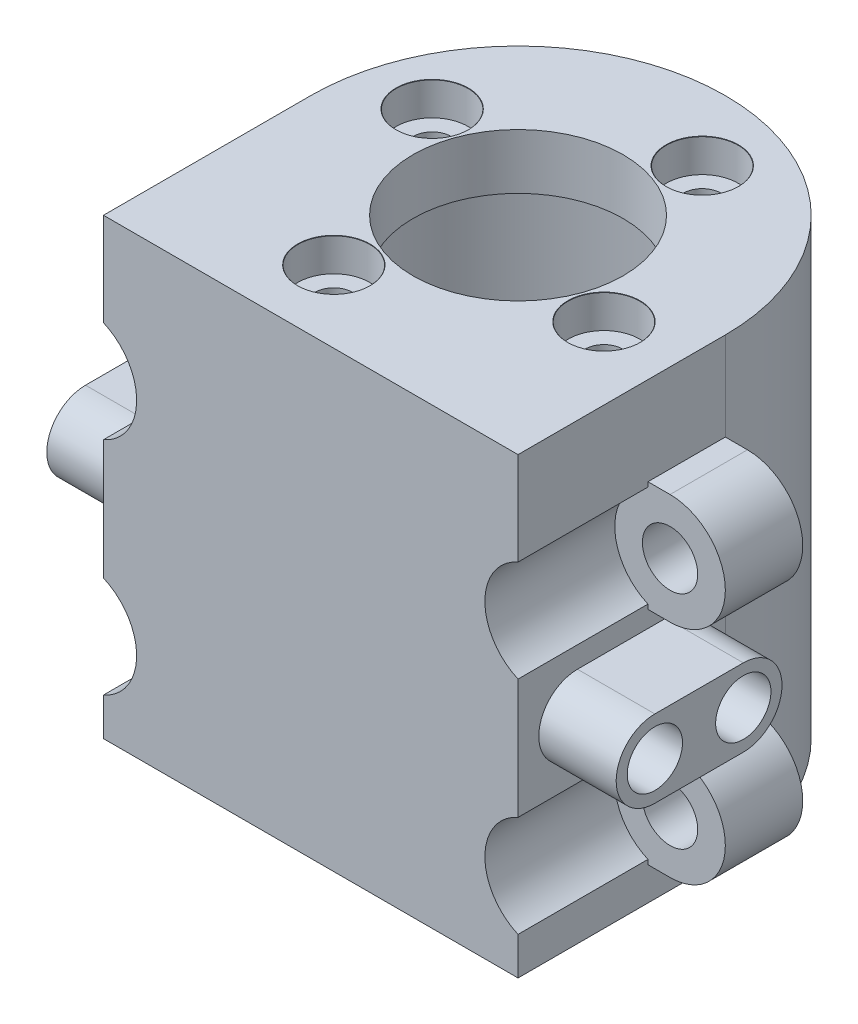
from build123d import *

# Parameters (mm, degrees)
SKETCH1_R                     = 18.75
SKETCH1_R_2                   = 16.2
BOSS_EXTRUDE1_DEPTH           = 36
BOSS_EXTRUDE2_DEPTH           = 7
CUT_EXTRUDE2_START            = 7
CUT_EXTRUDE2_DEPTH            = 11.75
CUT_EXTRUDE5_START            = 7
CUT_EXTRUDE5_DEPTH            = 5
SKETCH8_R                     = 2.5
BOSS_EXTRUDE5_DEPTH           = 7
BOSS_EXTRUDE4_DEPTH           = 5
CUT_EXTRUDE3_REACH            = 53.919
SKETCH4_R                     = 9.5
CBORE_FOR_M3_SHCS1_AT_2_COUNT = 2
CBORE_FOR_M3_SHCS1_AT_2_PITCH = 18.384776311
CBORE_FOR_M3_SHCS1_AT_3_COUNT = 2
CBORE_FOR_M3_SHCS1_AT_3_PITCH = 26
CBORE_FOR_M3_SHCS1_AT_4_COUNT = 2
CBORE_FOR_M3_SHCS1_AT_4_PITCH = 18.384776311


with BuildPart() as part:
    # Sketch1 → Boss-Extrude1 (new body)
    # profile 1 of 3: a face of its own
    with BuildSketch(Plane(origin=(0, 0, 0), x_dir=(1, 0, 0), z_dir=(0, 1, 0))):
        with BuildLine():
            ThreePointArc((0, -18.75), (-13.258252147, -13.258252147), (-18.75, 0))
            Line((-18.75, 0), (-18.75, -18.75))
            Line((-18.75, -18.75), (0, -18.75))
        make_face()
    # profile 2 of 3: a face of its own
    with BuildSketch(Plane(origin=(0, 0, 0), x_dir=(1, 0, 0), z_dir=(0, 1, 0))):
        Circle(SKETCH1_R)
        with Locations(Location((0, 0, 0), (0, 0, 270))):
            Circle(SKETCH1_R_2, mode=Mode.SUBTRACT)
    # profile 3 of 3: a face of its own
    with BuildSketch(Plane(origin=(0, 0, 0), x_dir=(1, 0, 0), z_dir=(0, 1, 0))):
        with BuildLine():
            Line((18.75, -18.75), (18.75, 0))
            ThreePointArc((18.75, 0), (13.258252147, -13.258252147), (0, -18.75))
            Line((0, -18.75), (18.75, -18.75))
        make_face()
    extrude(amount=BOSS_EXTRUDE1_DEPTH)

    # Sketch2 → Boss-Extrude2 (add)
    with BuildSketch(Plane.XY):
        with BuildLine():
            Line((18.75, 33), (18.75, 23))
            Line((18.75, 23), (20.75, 23))
            ThreePointArc((20.75, 23), (25.75, 28), (20.75, 33))
            Line((20.75, 33), (18.75, 33))
        make_face()
        with BuildLine():
            Line((20.75, 13), (18.75, 13))
            Line((18.75, 13), (18.75, 3))
            Line((18.75, 3), (20.75, 3))
            ThreePointArc((20.75, 3), (25.75, 8), (20.75, 13))
        make_face()
    boss_extrude2 = extrude(amount=BOSS_EXTRUDE2_DEPTH)

    # Sketch2<5> → Cut-Extrude2 (cut)
    with BuildSketch(Plane.XY.offset(CUT_EXTRUDE2_START)):
        with BuildLine():
            ThreePointArc((18.75, 32.582575695), (15.75, 28), (18.75, 23.417424305))
            Line((18.75, 23.417424305), (18.75, 32.582575695))
        make_face()
        with BuildLine():
            ThreePointArc((18.75, 12.582575695), (15.75, 8), (18.75, 3.417424305))
            Line((18.75, 3.417424305), (18.75, 12.582575695))
        make_face()
    cut_extrude2 = extrude(amount=CUT_EXTRUDE2_DEPTH, mode=Mode.SUBTRACT)

    # Sketch2<7> → Cut-Extrude5 (cut)
    with BuildSketch(Plane.XY.offset(CUT_EXTRUDE5_START)):
        with BuildLine():
            ThreePointArc((23.25, 28), (21.540569415, 30.371708245), (18.75, 29.5))
            Line((18.75, 29.5), (18.75, 26.5))
            ThreePointArc((18.75, 26.5), (21.540569415, 25.628291755), (23.25, 28))
        make_face()
        with BuildLine():
            Line((18.75, 26.5), (18.75, 29.5))
            ThreePointArc((18.75, 29.5), (18.25, 28), (18.75, 26.5))
        make_face()
        with BuildLine():
            ThreePointArc((23.25, 8), (21.540569415, 10.371708245), (18.75, 9.5))
            Line((18.75, 9.5), (18.75, 6.5))
            ThreePointArc((18.75, 6.5), (21.540569415, 5.628291755), (23.25, 8))
        make_face()
        with BuildLine():
            Line((18.75, 6.5), (18.75, 9.5))
            ThreePointArc((18.75, 9.5), (18.25, 8), (18.75, 6.5))
        make_face()
    cut_extrude5 = extrude(amount=-CUT_EXTRUDE5_DEPTH, mode=Mode.SUBTRACT)

    # Sketch8 → Boss-Extrude5 (add)
    with BuildSketch(Plane(origin=(18.75, 0, 0), x_dir=(0, 0, -1), z_dir=(1, 0, 0))):
        with BuildLine():
            Line((-13.375, 21.5), (-5.375, 21.5))
            ThreePointArc((-5.375, 21.5), (-1.875, 18), (-5.375, 14.5))
            Line((-5.375, 14.5), (-13.375, 14.5))
            ThreePointArc((-13.375, 14.5), (-16.875, 18), (-13.375, 21.5))
        make_face()
        with Locations((-13.375, 18)):
            Circle(SKETCH8_R, mode=Mode.SUBTRACT)
        with Locations((-5.375, 18)):
            Circle(SKETCH8_R, mode=Mode.SUBTRACT)
    boss_extrude5 = extrude(amount=BOSS_EXTRUDE5_DEPTH)

    # Mirror1: Boss-Extrude2, Cut-Extrude2, Cut-Extrude5, Boss-Extrude5 across plane
    add(boss_extrude2.mirror(Plane(origin=(0, 0, 0), x_dir=(0, 0, 1), z_dir=(1, 0, 0))))
    add(cut_extrude2.mirror(Plane(origin=(0, 0, 0), x_dir=(0, 0, 1), z_dir=(1, 0, 0))), mode=Mode.SUBTRACT)
    add(cut_extrude5.mirror(Plane(origin=(0, 0, 0), x_dir=(0, 0, 1), z_dir=(1, 0, 0))), mode=Mode.SUBTRACT)
    add(boss_extrude5.mirror(Plane(origin=(0, 0, 0), x_dir=(0, 0, 1), z_dir=(1, 0, 0))))

    # Sketch3 → Boss-Extrude4 (add)
    with BuildSketch(Plane(origin=(0, 36, 0), x_dir=(1, 0, 0), z_dir=(0, 1, 0))):
        with BuildLine():
            Line((-18.75, -18.75), (18.75, -18.75))
            Line((18.75, -18.75), (18.75, 0))
            ThreePointArc((18.75, 0), (0, 18.75), (-18.75, 0))
            Line((-18.75, 0), (-18.75, -18.75))
        make_face()
    extrude(amount=BOSS_EXTRUDE4_DEPTH)

    # Sketch4 → Cut-Extrude3 (cut, up to next)
    with BuildSketch(Plane(origin=(0, 41, 0), x_dir=(1, 0, 0), z_dir=(0, 1, 0)), mode=Mode.PRIVATE) as cut_extrude3_sk1:
        with Locations(Location((0, 0, 0), (0, 0, 270))):
            Circle(SKETCH4_R)
    cut_extrude3_tool1 = extrude(cut_extrude3_sk1.sketch, amount=-CUT_EXTRUDE3_REACH, mode=Mode.PRIVATE) & part.part
    add(cut_extrude3_tool1.solids().sort_by_distance((0, 41, 0))[0], mode=Mode.SUBTRACT)

    # Sketch6 → CBORE for M3 SHCS1 (revolve, cut)
    with BuildSketch(Plane(origin=(-12.21600407, 41, -4.446261863), x_dir=(0, 0, 1), z_dir=(1, 0, 0))):
        Polygon((0, 0), (0, 41), (1.7, 41), (1.7, 3), (3.25, 3), (3.25, 0.025), (3.275, 0), align=None)
    cbore_for_m3_shcs1 = revolve(axis=Axis((-12.21600407, 47.35, -4.446261863), (0, -1, 0)), mode=Mode.SUBTRACT)

    # CBORE for M3 SHCS1 at 2: CBORE for M3 SHCS1 ×2
    with Locations(*[Vector(0.9063077870366504, 0, -0.42261826174069866) * (i * CBORE_FOR_M3_SHCS1_AT_2_PITCH) for i in range(1, CBORE_FOR_M3_SHCS1_AT_2_COUNT)]):
        add(cbore_for_m3_shcs1, mode=Mode.SUBTRACT)

    # CBORE for M3 SHCS1 at 3: CBORE for M3 SHCS1 ×2
    with Locations(*[Vector(0.9396926207859081, 0, 0.34202014332566943) * (i * CBORE_FOR_M3_SHCS1_AT_3_PITCH) for i in range(1, CBORE_FOR_M3_SHCS1_AT_3_COUNT)]):
        add(cbore_for_m3_shcs1, mode=Mode.SUBTRACT)

    # CBORE for M3 SHCS1 at 4: CBORE for M3 SHCS1 ×2
    with Locations(*[Vector(0.42261826174069556, 0, 0.9063077870366518) * (i * CBORE_FOR_M3_SHCS1_AT_4_PITCH) for i in range(1, CBORE_FOR_M3_SHCS1_AT_4_COUNT)]):
        add(cbore_for_m3_shcs1, mode=Mode.SUBTRACT)


solid = part.part
